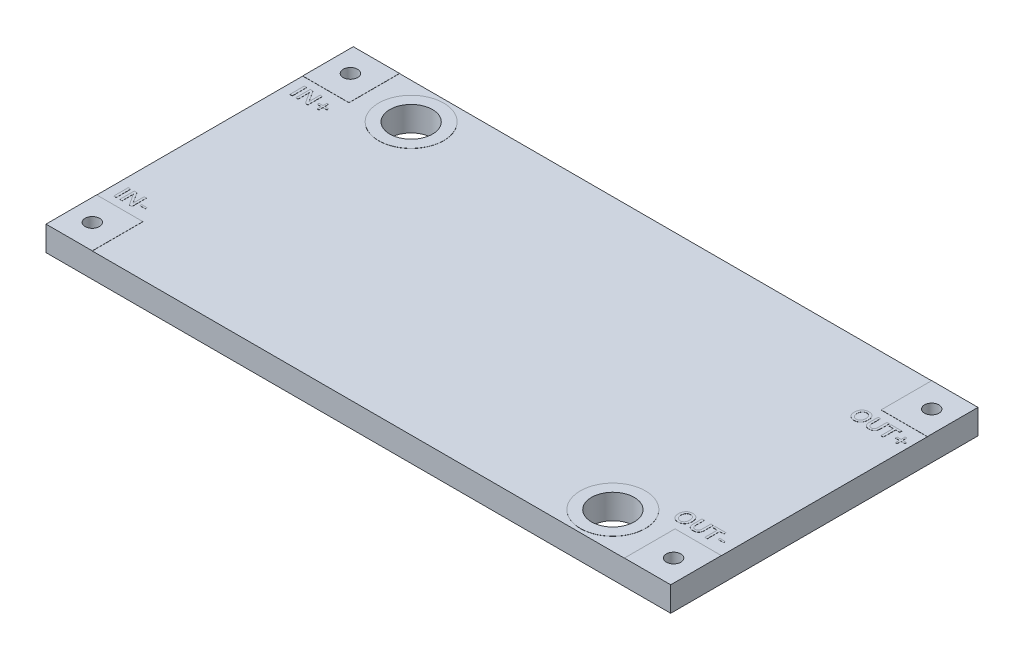
from build123d import *

# Parameters (mm, degrees)
SKETCH1_W           = 43.2
SKETCH1_H           = 21.25
BOSS_EXTRUDE1_DEPTH = 1.7
SKETCH2_R           = 1.475
SKETCH2_R_2         = 0.5
CUT_EXTRUDE1_DEPTH  = 25.131734811
SKETCH3_R           = 2.25
SKETCH3_R_2         = 1.475
SKETCH3_W           = 3.2
SKETCH3_H           = 3.5
SKETCH3_R_3         = 0.5
BOSS_EXTRUDE2_DEPTH = 0.01
SKETCH4_W           = 0.170024671
SKETCH4_H           = 1
SKETCH4_W_2         = 0.37890625
SKETCH4_H_2         = 0.118421053
BOSS_EXTRUDE3_DEPTH = 0.01


with BuildPart() as part:
    # Sketch1 → Boss-Extrude1 (new body)
    with BuildSketch(Plane(origin=(0, 0, 0), x_dir=(1, 0, 0), z_dir=(0, 1, 0))):
        Rectangle(SKETCH1_W, SKETCH1_H)
    extrude(amount=BOSS_EXTRUDE1_DEPTH)

    # Sketch2 → Cut-Extrude1 (cut, through all)
    with BuildSketch(Plane(origin=(0, 0, 0), x_dir=(1, 0, 0), z_dir=(0, 1, 0))):
        with Locations(Location((-15.1, 8.125, 0), (0, 0, 270))):
            Circle(SKETCH2_R)
        with Locations(Location((-20.1, 8.925, 0), (0, 0, 270))):
            Circle(SKETCH2_R_2)
        with Locations(Location((15.1, -8.125, 0), (0, 0, 270))):
            Circle(SKETCH2_R)
        with Locations(Location((20.1, -8.925, 0), (0, 0, 270))):
            Circle(SKETCH2_R_2)
        with Locations(Location((20.1, 8.925, 0), (0, 0, 90))):
            Circle(SKETCH2_R_2)
        with Locations(Location((-20.1, -8.925, 0), (0, 0, 90))):
            Circle(SKETCH2_R_2)
    extrude(amount=CUT_EXTRUDE1_DEPTH, mode=Mode.SUBTRACT)

    # Sketch3 → Boss-Extrude2 (add)
    # profile 1 of 6: a face of its own
    with BuildSketch(Plane(origin=(0, 1.7, 0), x_dir=(1, 0, 0), z_dir=(0, 1, 0))):
        with Locations(Location((-15.1, 8.125, 0), (0, 0, 90))):
            Circle(SKETCH3_R)
        with Locations(Location((-15.1, 8.125, 0), (0, 0, 270))):
            Circle(SKETCH3_R_2, mode=Mode.SUBTRACT)
    # profile 2 of 6: a face of its own
    with BuildSketch(Plane(origin=(0, 1.7, 0), x_dir=(1, 0, 0), z_dir=(0, 1, 0))):
        with Locations(Location((15.1, -8.125, 0), (0, 0, 90))):
            Circle(SKETCH3_R)
        with Locations(Location((15.1, -8.125, 0), (0, 0, 270))):
            Circle(SKETCH3_R_2, mode=Mode.SUBTRACT)
    # profile 3 of 6: a face of its own
    with BuildSketch(Plane(origin=(0, 1.7, 0), x_dir=(1, 0, 0), z_dir=(0, 1, 0))):
        with Locations((-20, 8.875)):
            Rectangle(SKETCH3_W, SKETCH3_H)
        with Locations(Location((-20.1, 8.925, 0), (0, 0, 270))):
            Circle(SKETCH3_R_3, mode=Mode.SUBTRACT)
    # profile 4 of 6: a face of its own
    with BuildSketch(Plane(origin=(0, 1.7, 0), x_dir=(1, 0, 0), z_dir=(0, 1, 0))):
        with Locations((-20, -8.875)):
            Rectangle(SKETCH3_W, SKETCH3_H)
        with Locations(Location((-20.1, -8.925, 0), (0, 0, 90))):
            Circle(SKETCH3_R_3, mode=Mode.SUBTRACT)
    # profile 5 of 6: a face of its own
    with BuildSketch(Plane(origin=(0, 1.7, 0), x_dir=(1, 0, 0), z_dir=(0, 1, 0))):
        with Locations((20, -8.875)):
            Rectangle(SKETCH3_W, SKETCH3_H)
        with Locations(Location((20.1, -8.925, 0), (0, 0, 270))):
            Circle(SKETCH3_R_3, mode=Mode.SUBTRACT)
    # profile 6 of 6: a face of its own
    with BuildSketch(Plane(origin=(0, 1.7, 0), x_dir=(1, 0, 0), z_dir=(0, 1, 0))):
        with Locations((20, 8.875)):
            Rectangle(SKETCH3_W, SKETCH3_H)
        with Locations(Location((20.1, 8.925, 0), (0, 0, 90))):
            Circle(SKETCH3_R_3, mode=Mode.SUBTRACT)
    extrude(amount=BOSS_EXTRUDE2_DEPTH)

    # Sketch4 → Boss-Extrude3 (add)
    # profile 1 of 14: a face of its own
    with BuildSketch(Plane(origin=(0, 1.7, 0), x_dir=(1, 0, 0), z_dir=(0, 1, 0))):
        with Locations((-20.852438923, 6.075899594)):
            Rectangle(SKETCH4_W, SKETCH4_H)
    # profile 2 of 14: a face of its own
    with BuildSketch(Plane(origin=(0, 1.7, 0), x_dir=(1, 0, 0), z_dir=(0, 1, 0))):
        with BuildLine():
            Line((-19.685189745, 5.575899594), (-19.865494021, 5.575899594))
            Line((-19.865494021, 5.575899594), (-20.340822969, 6.31089137))
            add(Edge.make_bspline(
                [(-20.340822969, 6.31089137), (-20.34654146, 6.320295921), (-20.357860845, 6.338911621), (-20.366405755, 6.358952171), (-20.370633824, 6.368868344)],
                knots=[0, 0, 0, 0, 1.010389057, 2, 2, 2, 2], degree=3))
            Line((-20.370633824, 6.368868344), (-20.374745666, 6.368868344))
            add(Edge.make_bspline(
                [(-20.374745666, 6.368868344), (-20.374325341, 6.365785885), (-20.373392772, 6.358946868), (-20.372063704, 6.347515569), (-20.371450169, 6.333779731), (-20.3705252, 6.317752766), (-20.369949118, 6.299449662), (-20.369617758, 6.278819113), (-20.369072437, 6.255932042), (-20.369152789, 6.23989393), (-20.369194679, 6.231532818)],
                knots=[0, 0, 0, 0, 0.542850591, 1.204416297, 2.006997007, 2.940909611, 4.005733812, 5.201725499, 6.541181877, 8, 8, 8, 8], degree=3))
            Line((-20.369194679, 6.231532818), (-20.369194679, 5.575899594))
            Line((-20.369194679, 5.575899594), (-20.528939745, 5.575899594))
            Line((-20.528939745, 5.575899594), (-20.528939745, 6.575899594))
            Line((-20.528939745, 6.575899594), (-20.336711126, 6.575899594))
            Line((-20.336711126, 6.575899594), (-19.877212771, 5.858383147))
            add(Edge.make_bspline(
                [(-19.877212771, 5.858383147), (-19.872803757, 5.851544578), (-19.86472599, 5.839015618), (-19.85411523, 5.821873507), (-19.845964808, 5.808266036), (-19.841625663, 5.800280254), (-19.839795008, 5.796911107)],
                knots=[0, 0, 0, 0, 1.356381881, 2.48503099, 3.360844982, 4, 4, 4, 4], degree=3))
            Line((-19.839795008, 5.796911107), (-19.837122311, 5.796911107))
            add(Edge.make_bspline(
                [(-19.837122311, 5.796911107), (-19.83771686, 5.8004688), (-19.839004079, 5.808171316), (-19.840032502, 5.820758925), (-19.841330637, 5.835000209), (-19.842409475, 5.85096876), (-19.842850435, 5.868663676), (-19.843639937, 5.888119478), (-19.843671104, 5.909302235), (-19.843826334, 5.923967309), (-19.84390685, 5.931573936)],
                knots=[0, 0, 0, 0, 0.641182925, 1.388181035, 2.244403229, 3.184783092, 4.233507647, 5.391855368, 6.647181581, 8, 8, 8, 8], degree=3))
            Line((-19.84390685, 5.931573936), (-19.84390685, 6.575899594))
            Line((-19.84390685, 6.575899594), (-19.685189745, 6.575899594))
            Line((-19.685189745, 6.575899594), (-19.685189745, 5.575899594))
        make_face()
    # profile 3 of 14: a face of its own
    with BuildSketch(Plane(origin=(0, 1.7, 0), x_dir=(1, 0, 0), z_dir=(0, 1, 0))):
        Polygon((-18.731653561, 5.931162752), (-19.005707837, 5.931162752), (-19.005707837, 5.654846962), (-19.12022264, 5.654846962), (-19.12022264, 5.931162752), (-19.394276916, 5.931162752), (-19.394276916, 6.049583805), (-19.12022264, 6.049583805), (-19.12022264, 6.325899594), (-19.005707837, 6.325899594), (-19.005707837, 6.049583805), (-18.731653561, 6.049583805), align=None)
    # profile 4 of 14: a face of its own
    with BuildSketch(Plane(origin=(0, 1.7, 0), x_dir=(1, 0, 0), z_dir=(0, 1, 0))):
        with Locations((-20.852438923, -6.097777607)):
            Rectangle(SKETCH4_W, SKETCH4_H)
    # profile 5 of 14: a face of its own
    with BuildSketch(Plane(origin=(0, 1.7, 0), x_dir=(1, 0, 0), z_dir=(0, 1, 0))):
        with BuildLine():
            Line((-19.685189745, -6.597777607), (-19.865494021, -6.597777607))
            Line((-19.865494021, -6.597777607), (-20.340822969, -5.862785831))
            add(Edge.make_bspline(
                [(-20.340822969, -5.862785831), (-20.34654146, -5.853381281), (-20.357860845, -5.83476558), (-20.366405755, -5.814725031), (-20.370633824, -5.804808857)],
                knots=[0, 0, 0, 0, 1.010389057, 2, 2, 2, 2], degree=3))
            Line((-20.370633824, -5.804808857), (-20.374745666, -5.804808857))
            add(Edge.make_bspline(
                [(-20.374745666, -5.804808857), (-20.374325341, -5.807891316), (-20.373392772, -5.814730333), (-20.372063704, -5.826161632), (-20.371450169, -5.83989747), (-20.3705252, -5.855924436), (-20.369949118, -5.87422754), (-20.369617758, -5.894858089), (-20.369072437, -5.917745159), (-20.369152789, -5.933783271), (-20.369194679, -5.942144384)],
                knots=[0, 0, 0, 0, 0.542850591, 1.204416297, 2.006997007, 2.940909611, 4.005733812, 5.201725499, 6.541181877, 8, 8, 8, 8], degree=3))
            Line((-20.369194679, -5.942144384), (-20.369194679, -6.597777607))
            Line((-20.369194679, -6.597777607), (-20.528939745, -6.597777607))
            Line((-20.528939745, -6.597777607), (-20.528939745, -5.597777607))
            Line((-20.528939745, -5.597777607), (-20.336711126, -5.597777607))
            Line((-20.336711126, -5.597777607), (-19.877212771, -6.315294055))
            add(Edge.make_bspline(
                [(-19.877212771, -6.315294055), (-19.872803757, -6.322132623), (-19.86472599, -6.334661583), (-19.85411523, -6.351803695), (-19.845964808, -6.365411166), (-19.841625663, -6.373396948), (-19.839795008, -6.376766094)],
                knots=[0, 0, 0, 0, 1.356381881, 2.48503099, 3.360844982, 4, 4, 4, 4], degree=3))
            Line((-19.839795008, -6.376766094), (-19.837122311, -6.376766094))
            add(Edge.make_bspline(
                [(-19.837122311, -6.376766094), (-19.83771686, -6.373208401), (-19.839004079, -6.365505886), (-19.840032502, -6.352918277), (-19.841330637, -6.338676992), (-19.842409475, -6.322708442), (-19.842850435, -6.305013525), (-19.843639937, -6.285557723), (-19.843671104, -6.264374967), (-19.843826334, -6.249709892), (-19.84390685, -6.242103265)],
                knots=[0, 0, 0, 0, 0.641182925, 1.388181035, 2.244403229, 3.184783092, 4.233507647, 5.391855368, 6.647181581, 8, 8, 8, 8], degree=3))
            Line((-19.84390685, -6.242103265), (-19.84390685, -5.597777607))
            Line((-19.84390685, -5.597777607), (-19.685189745, -5.597777607))
            Line((-19.685189745, -5.597777607), (-19.685189745, -6.597777607))
        make_face()
    # profile 6 of 14: a face of its own
    with BuildSketch(Plane(origin=(0, 1.7, 0), x_dir=(1, 0, 0), z_dir=(0, 1, 0))):
        with Locations((-19.27020208, -6.209619713)):
            Rectangle(SKETCH4_W_2, SKETCH4_H_2)
    # profile 7 of 14: a face of its own
    with BuildSketch(Plane(origin=(0, 1.7, 0), x_dir=(1, 0, 0), z_dir=(0, 1, 0))):
        with BuildLine():
            add(Edge.make_bspline(
                [(18.082538877, 5.562741699), (18.065044998, 5.563194363), (18.030828975, 5.564079722), (17.980815608, 5.570465796), (17.933499786, 5.581360524), (17.888833922, 5.596613073), (17.84675845, 5.616178356), (17.8075888, 5.640458261), (17.770862125, 5.668768002), (17.737315693, 5.701416599), (17.707239746, 5.737566169), (17.680667293, 5.776359769), (17.658435613, 5.817987884), (17.640031245, 5.862161287), (17.625885134, 5.909016789), (17.61584568, 5.958428037), (17.609819326, 6.010440216), (17.609044893, 6.046003971), (17.608649075, 6.064180844)],
                knots=[0, 0, 0, 0, 1.080688534, 2.113702916, 3.108931422, 4.075669577, 5.024646271, 5.969410339, 6.917101566, 7.884256872, 8.855186167, 9.818171139, 10.784287868, 11.765612141, 12.770163835, 13.803152185, 14.877176389, 16, 16, 16, 16], degree=3))
            add(Edge.make_bspline(
                [(17.608649075, 6.064180844), (17.60902151, 6.083661091), (17.609748676, 6.121695593), (17.616070295, 6.177248847), (17.626175781, 6.229769327), (17.64064918, 6.279255719), (17.659134947, 6.325816033), (17.682007984, 6.369262503), (17.708947669, 6.409707591), (17.739745804, 6.446846772), (17.773991489, 6.480446284), (17.811624929, 6.509586269), (17.8522784, 6.534202395), (17.895794961, 6.554512682), (17.942463245, 6.569754539), (17.991816929, 6.581232651), (18.044261223, 6.587753142), (18.080191318, 6.588616003), (18.098575062, 6.589057489)],
                knots=[0, 0, 0, 0, 1.15222704, 2.249682958, 3.303300419, 4.313064797, 5.295631801, 6.262317599, 7.212562825, 8.165710149, 9.111907019, 10.045395757, 10.97510803, 11.91840756, 12.880046247, 13.874430042, 14.912445645, 16, 16, 16, 16], degree=3))
            add(Edge.make_bspline(
                [(18.098575062, 6.589057489), (18.115657255, 6.58860247), (18.14905297, 6.587712909), (18.197853716, 6.58136688), (18.243997991, 6.570303312), (18.287827157, 6.555465072), (18.328960585, 6.53576357), (18.367478907, 6.511730906), (18.40342934, 6.483361218), (18.436621527, 6.450952989), (18.466476029, 6.415054604), (18.492881339, 6.37641967), (18.514914443, 6.334875364), (18.53277228, 6.290663628), (18.546833159, 6.243868595), (18.556818224, 6.194462892), (18.562877003, 6.142319589), (18.563643239, 6.106686506), (18.564035588, 6.088440712)],
                knots=[0, 0, 0, 0, 1.065808981, 2.083658202, 3.063810198, 4.022601448, 4.965556375, 5.902929278, 6.849938112, 7.817604304, 8.792171557, 9.758797867, 10.732511031, 11.720347187, 12.729563492, 13.777019773, 14.861730821, 16, 16, 16, 16], degree=3))
            add(Edge.make_bspline(
                [(18.564035588, 6.088440712), (18.563661485, 6.068687355), (18.562932134, 6.030176222), (18.556660588, 5.973994363), (18.54639752, 5.920989541), (18.532378357, 5.8709808), (18.513803091, 5.824277725), (18.491027533, 5.780871668), (18.464427597, 5.740413706), (18.433616397, 5.703569218), (18.399487465, 5.67045022), (18.362524502, 5.641383389), (18.322606881, 5.617032475), (18.279895722, 5.597177221), (18.234450178, 5.581779097), (18.186256246, 5.570659835), (18.135286827, 5.564028952), (18.100376708, 5.563177011), (18.082538877, 5.562741699)],
                knots=[0, 0, 0, 0, 1.177234893, 2.295136328, 3.364707178, 4.392715417, 5.386476074, 6.354925964, 7.310067309, 8.267250732, 9.211947684, 10.14028609, 11.064408358, 11.992845631, 12.942370588, 13.919441291, 14.936908422, 16, 16, 16, 16], degree=3))
        make_face()
        with BuildLine():
            add(Edge.make_bspline(
                [(18.090145785, 6.444320647), (18.079027753, 6.443995901), (18.057168711, 6.443357421), (18.025159802, 6.438586548), (17.994769235, 6.430536021), (17.965996639, 6.419392074), (17.938801294, 6.405070541), (17.913177567, 6.387509084), (17.889287751, 6.366567328), (17.867174085, 6.342800187), (17.847220399, 6.316409333), (17.82969933, 6.28787367), (17.81517933, 6.257180426), (17.802804982, 6.22474567), (17.793786127, 6.190025026), (17.786902111, 6.153430984), (17.783065361, 6.114769171), (17.782472364, 6.088380086), (17.782168812, 6.074871633)],
                knots=[0, 0, 0, 0, 0.988164096, 1.942818717, 2.869377484, 3.777873969, 4.679912813, 5.595814758, 6.532869555, 7.498464472, 8.476908715, 9.469532548, 10.469588381, 11.491398077, 12.550994941, 13.653913012, 14.799048759, 16, 16, 16, 16], degree=3))
            add(Edge.make_bspline(
                [(17.782168812, 6.074871633), (17.782378915, 6.061429864), (17.782789346, 6.035171753), (17.78677543, 5.996747958), (17.793330103, 5.960328606), (17.802305788, 5.925827415), (17.814019847, 5.89338011), (17.828548153, 5.863026801), (17.845369286, 5.834481019), (17.864860493, 5.808276182), (17.886398449, 5.784628863), (17.909667641, 5.763876534), (17.934736556, 5.746557285), (17.961298848, 5.732161203), (17.989534538, 5.721041707), (18.019364385, 5.713297834), (18.050716429, 5.708398222), (18.072172129, 5.707789934), (18.083155654, 5.707478541)],
                knots=[0, 0, 0, 0, 1.209576796, 2.362873517, 3.472383614, 4.537664675, 5.56795712, 6.572273746, 7.56245417, 8.545712799, 9.506284641, 10.437062317, 11.345664602, 12.242634409, 13.150985398, 14.06964528, 15.011819787, 16, 16, 16, 16], degree=3))
            add(Edge.make_bspline(
                [(18.083155654, 5.707478541), (18.094752066, 5.707730531), (18.117489057, 5.708224606), (18.150635314, 5.712807811), (18.181840434, 5.720403689), (18.211172317, 5.730950422), (18.238562652, 5.744534178), (18.264120322, 5.761126291), (18.287685831, 5.78082796), (18.309259486, 5.803459959), (18.328539045, 5.828813596), (18.345573208, 5.856500131), (18.359683026, 5.886772442), (18.371549602, 5.919329911), (18.380111738, 5.954477323), (18.386802424, 5.991806843), (18.390708332, 6.031545582), (18.391124716, 6.05882698), (18.391338219, 6.072815712)],
                knots=[0, 0, 0, 0, 1.028528343, 2.016627255, 2.961983855, 3.873731828, 4.776575143, 5.668789617, 6.571141343, 7.495835697, 8.437174697, 9.392452997, 10.374395704, 11.395763051, 12.462046906, 13.579731582, 14.758990046, 16, 16, 16, 16], degree=3))
            add(Edge.make_bspline(
                [(18.391338219, 6.072815712), (18.391105827, 6.087213871), (18.390653507, 6.115237857), (18.387029599, 6.156006274), (18.380514348, 6.194224153), (18.372192655, 6.230035074), (18.3606639, 6.263195046), (18.347080713, 6.293996634), (18.330423513, 6.322033421), (18.311820512, 6.347694121), (18.290709242, 6.370321004), (18.267825576, 6.390303328), (18.242780224, 6.407023859), (18.21581917, 6.420633411), (18.187091484, 6.431417144), (18.156459199, 6.438957789), (18.123937438, 6.443602039), (18.101606519, 6.444076924), (18.090145785, 6.444320647)],
                knots=[0, 0, 0, 0, 1.275930431, 2.483418728, 3.622659341, 4.709777534, 5.737328229, 6.729540964, 7.687827304, 8.621963811, 9.533051901, 10.424350274, 11.308689573, 12.194154331, 13.095493964, 14.02201801, 14.984854798, 16, 16, 16, 16], degree=3))
        make_face(mode=Mode.SUBTRACT)
    # profile 8 of 14: a face of its own
    with BuildSketch(Plane(origin=(0, 1.7, 0), x_dir=(1, 0, 0), z_dir=(0, 1, 0))):
        with BuildLine():
            add(Edge.make_bspline(
                [(19.516749404, 5.982560778), (19.516411646, 5.965624383), (19.515755385, 5.932717131), (19.511332863, 5.885000437), (19.503575875, 5.840570286), (19.492613111, 5.799469759), (19.47908452, 5.761415595), (19.461798974, 5.726814906), (19.441721941, 5.695354451), (19.418194622, 5.667269857), (19.391559503, 5.642538617), (19.361897045, 5.620982298), (19.329158737, 5.602705742), (19.29313322, 5.588315171), (19.254212416, 5.576664643), (19.21219367, 5.568644374), (19.167092115, 5.563595055), (19.136007101, 5.563032282), (19.11995664, 5.562741699)],
                knots=[0, 0, 0, 0, 1.226853155, 2.383763919, 3.467655837, 4.490011703, 5.462137187, 6.387943758, 7.285775493, 8.159766112, 9.034419151, 9.912222379, 10.810054113, 11.743007316, 12.716842562, 13.748867616, 14.83764852, 16, 16, 16, 16], degree=3))
            add(Edge.make_bspline(
                [(19.11995664, 5.562741699), (19.104592333, 5.563051613), (19.074747085, 5.563653623), (19.031505148, 5.568459261), (18.991188777, 5.576067695), (18.953905028, 5.587305339), (18.919468745, 5.601313217), (18.88803203, 5.618825872), (18.859517761, 5.639309299), (18.834247576, 5.663355511), (18.811598667, 5.690167835), (18.792266776, 5.720436525), (18.775961831, 5.753855057), (18.76268836, 5.790405584), (18.752173971, 5.830027578), (18.744973428, 5.872768112), (18.74030133, 5.918586193), (18.739846213, 5.95020201), (18.739611246, 5.966524594)],
                knots=[0, 0, 0, 0, 1.158846926, 2.251066199, 3.278205435, 4.249804329, 5.184010756, 6.07736631, 6.958474974, 7.825285059, 8.702395332, 9.600153407, 10.527352038, 11.502219312, 12.529306499, 13.615587086, 14.768977538, 16, 16, 16, 16], degree=3))
            Line((18.739611246, 5.966524594), (18.739611246, 6.575899594))
            Line((18.739611246, 6.575899594), (18.904701706, 6.575899594))
            Line((18.904701706, 6.575899594), (18.904701706, 6.000652883))
            add(Edge.make_bspline(
                [(18.904701706, 6.000652883), (18.904832494, 5.988791782), (18.905085361, 5.965859347), (18.907794079, 5.932554037), (18.912270898, 5.901585907), (18.918358355, 5.872825135), (18.926327228, 5.846374542), (18.936246874, 5.822251974), (18.947631837, 5.800251077), (18.961231875, 5.780814212), (18.97614746, 5.763308324), (18.993318524, 5.748432643), (19.01204245, 5.735516783), (19.032811543, 5.725294455), (19.055218459, 5.717216082), (19.079347741, 5.711476317), (19.105271959, 5.708242551), (19.123100073, 5.707738452), (19.132292167, 5.707478541)],
                knots=[0, 0, 0, 0, 1.343123546, 2.596815513, 3.781197858, 4.884908217, 5.923490635, 6.905054976, 7.835546472, 8.72258405, 9.586361395, 10.433341515, 11.288004071, 12.15578242, 13.04702078, 13.980776091, 14.958897414, 16, 16, 16, 16], degree=3))
            add(Edge.make_bspline(
                [(19.132292167, 5.707478541), (19.141143849, 5.707647559), (19.158364259, 5.707976373), (19.183364407, 5.711340795), (19.206701879, 5.716776964), (19.22824198, 5.724708847), (19.248166731, 5.734505433), (19.266232448, 5.746815818), (19.282614926, 5.761318407), (19.297206908, 5.77811642), (19.310311552, 5.796931718), (19.321358551, 5.81813398), (19.330822375, 5.841390079), (19.338398767, 5.86695466), (19.344273767, 5.894669401), (19.34851486, 5.924548313), (19.351292711, 5.956603771), (19.351533998, 5.978716862), (19.351658943, 5.990167686)],
                knots=[0, 0, 0, 0, 1.039273001, 2.021842695, 2.957137814, 3.848510232, 4.71256286, 5.558805872, 6.408526268, 7.275648631, 8.166657446, 9.095765165, 10.077939035, 11.111960622, 12.223548368, 13.403025483, 14.655208456, 16, 16, 16, 16], degree=3))
            Line((19.351658943, 5.990167686), (19.351658943, 6.575899594))
            Line((19.351658943, 6.575899594), (19.516749404, 6.575899594))
            Line((19.516749404, 6.575899594), (19.516749404, 5.982560778))
        make_face()
    # profile 9 of 14: a face of its own
    with BuildSketch(Plane(origin=(0, 1.7, 0), x_dir=(1, 0, 0), z_dir=(0, 1, 0))):
        Polygon((20.389693483, 6.431162752), (20.103920456, 6.431162752), (20.103920456, 5.575899594), (19.938829996, 5.575899594), (19.938829996, 6.431162752), (19.653673746, 6.431162752), (19.653673746, 6.575899594), (20.389693483, 6.575899594), align=None)
    # profile 10 of 14: a face of its own
    with BuildSketch(Plane(origin=(0, 1.7, 0), x_dir=(1, 0, 0), z_dir=(0, 1, 0))):
        Polygon((21.245984601, 5.931162752), (20.971930325, 5.931162752), (20.971930325, 5.654846962), (20.857415522, 5.654846962), (20.857415522, 5.931162752), (20.583361246, 5.931162752), (20.583361246, 6.049583805), (20.857415522, 6.049583805), (20.857415522, 6.325899594), (20.971930325, 6.325899594), (20.971930325, 6.049583805), (21.245984601, 6.049583805), align=None)
    # profile 11 of 14: a face of its own
    with BuildSketch(Plane(origin=(0, 1.7, 0), x_dir=(1, 0, 0), z_dir=(0, 1, 0))):
        with BuildLine():
            add(Edge.make_bspline(
                [(18.082538877, -6.610935502), (18.065044998, -6.610482838), (18.030828975, -6.60959748), (17.980815608, -6.603211406), (17.933499786, -6.592316677), (17.888833922, -6.577064128), (17.84675845, -6.557498846), (17.8075888, -6.53321894), (17.770862125, -6.504909199), (17.737315693, -6.472260602), (17.707239746, -6.436111032), (17.680667293, -6.397317433), (17.658435613, -6.355689317), (17.640031245, -6.311515914), (17.625885134, -6.264660412), (17.61584568, -6.215249164), (17.609819326, -6.163236985), (17.609044893, -6.12767323), (17.608649075, -6.109496357)],
                knots=[0, 0, 0, 0, 1.080688534, 2.113702916, 3.108931422, 4.075669577, 5.024646271, 5.969410339, 6.917101566, 7.884256872, 8.855186167, 9.818171139, 10.784287868, 11.765612141, 12.770163835, 13.803152185, 14.877176389, 16, 16, 16, 16], degree=3))
            add(Edge.make_bspline(
                [(17.608649075, -6.109496357), (17.60902151, -6.09001611), (17.609748676, -6.051981609), (17.616070295, -5.996428354), (17.626175781, -5.943907874), (17.64064918, -5.894421483), (17.659134947, -5.847861168), (17.682007984, -5.804414698), (17.708947669, -5.76396961), (17.739745804, -5.726830429), (17.773991489, -5.693230918), (17.811624929, -5.664090932), (17.8522784, -5.639474806), (17.895794961, -5.619164519), (17.942463245, -5.603922662), (17.991816929, -5.59244455), (18.044261223, -5.58592406), (18.080191318, -5.585061198), (18.098575062, -5.584619713)],
                knots=[0, 0, 0, 0, 1.15222704, 2.249682958, 3.303300419, 4.313064797, 5.295631801, 6.262317599, 7.212562825, 8.165710149, 9.111907019, 10.045395757, 10.97510803, 11.91840756, 12.880046247, 13.874430042, 14.912445645, 16, 16, 16, 16], degree=3))
            add(Edge.make_bspline(
                [(18.098575062, -5.584619713), (18.115657255, -5.585074731), (18.14905297, -5.585964292), (18.197853716, -5.592310321), (18.243997991, -5.60337389), (18.287827157, -5.618212129), (18.328960585, -5.637913631), (18.367478907, -5.661946295), (18.40342934, -5.690315983), (18.436621527, -5.722724212), (18.466476029, -5.758622598), (18.492881339, -5.797257531), (18.514914443, -5.838801837), (18.53277228, -5.883013573), (18.546833159, -5.929808606), (18.556818224, -5.97921431), (18.562877003, -6.031357613), (18.563643239, -6.066990695), (18.564035588, -6.085236489)],
                knots=[0, 0, 0, 0, 1.065808981, 2.083658202, 3.063810198, 4.022601448, 4.965556375, 5.902929278, 6.849938112, 7.817604304, 8.792171557, 9.758797867, 10.732511031, 11.720347187, 12.729563492, 13.777019773, 14.861730821, 16, 16, 16, 16], degree=3))
            add(Edge.make_bspline(
                [(18.564035588, -6.085236489), (18.563661485, -6.104989847), (18.562932134, -6.143500979), (18.556660588, -6.199682838), (18.54639752, -6.252687661), (18.532378357, -6.302696401), (18.513803091, -6.349399476), (18.491027533, -6.392805534), (18.464427597, -6.433263496), (18.433616397, -6.470107983), (18.399487465, -6.503226981), (18.362524502, -6.532293812), (18.322606881, -6.556644726), (18.279895722, -6.57649998), (18.234450178, -6.591898104), (18.186256246, -6.603017366), (18.135286827, -6.609648249), (18.100376708, -6.61050019), (18.082538877, -6.610935502)],
                knots=[0, 0, 0, 0, 1.177234893, 2.295136328, 3.364707178, 4.392715417, 5.386476074, 6.354925964, 7.310067309, 8.267250732, 9.211947684, 10.14028609, 11.064408358, 11.992845631, 12.942370588, 13.919441291, 14.936908422, 16, 16, 16, 16], degree=3))
        make_face()
        with BuildLine():
            add(Edge.make_bspline(
                [(18.090145785, -5.729356555), (18.079027753, -5.729681301), (18.057168711, -5.73031978), (18.025159802, -5.735090653), (17.994769235, -5.74314118), (17.965996639, -5.754285127), (17.938801294, -5.768606661), (17.913177567, -5.786168118), (17.889287751, -5.807109873), (17.867174085, -5.830877015), (17.847220399, -5.857267868), (17.82969933, -5.885803531), (17.81517933, -5.916496775), (17.802804982, -5.948931531), (17.793786127, -5.983652175), (17.786902111, -6.020246217), (17.783065361, -6.05890803), (17.782472364, -6.085297115), (17.782168812, -6.098805568)],
                knots=[0, 0, 0, 0, 0.988164096, 1.942818717, 2.869377484, 3.777873969, 4.679912813, 5.595814758, 6.532869555, 7.498464472, 8.476908715, 9.469532548, 10.469588381, 11.491398077, 12.550994941, 13.653913012, 14.799048759, 16, 16, 16, 16], degree=3))
            add(Edge.make_bspline(
                [(17.782168812, -6.098805568), (17.782378915, -6.112247337), (17.782789346, -6.138505448), (17.78677543, -6.176929243), (17.793330103, -6.213348595), (17.802305788, -6.247849787), (17.814019847, -6.280297091), (17.828548153, -6.3106504), (17.845369286, -6.339196182), (17.864860493, -6.365401019), (17.886398449, -6.389048338), (17.909667641, -6.409800668), (17.934736556, -6.427119916), (17.961298848, -6.441515998), (17.989534538, -6.452635494), (18.019364385, -6.460379368), (18.050716429, -6.465278979), (18.072172129, -6.465887267), (18.083155654, -6.46619866)],
                knots=[0, 0, 0, 0, 1.209576796, 2.362873517, 3.472383614, 4.537664675, 5.56795712, 6.572273746, 7.56245417, 8.545712799, 9.506284641, 10.437062317, 11.345664602, 12.242634409, 13.150985398, 14.06964528, 15.011819787, 16, 16, 16, 16], degree=3))
            add(Edge.make_bspline(
                [(18.083155654, -6.46619866), (18.094752066, -6.46594667), (18.117489057, -6.465452596), (18.150635314, -6.460869391), (18.181840434, -6.453273512), (18.211172317, -6.442726779), (18.238562652, -6.429143023), (18.264120322, -6.41255091), (18.287685831, -6.392849241), (18.309259486, -6.370217242), (18.328539045, -6.344863606), (18.345573208, -6.31717707), (18.359683026, -6.286904759), (18.371549602, -6.25434729), (18.380111738, -6.219199879), (18.386802424, -6.181870358), (18.390708332, -6.14213162), (18.391124716, -6.114850221), (18.391338219, -6.100861489)],
                knots=[0, 0, 0, 0, 1.028528343, 2.016627255, 2.961983855, 3.873731828, 4.776575143, 5.668789617, 6.571141343, 7.495835697, 8.437174697, 9.392452997, 10.374395704, 11.395763051, 12.462046906, 13.579731582, 14.758990046, 16, 16, 16, 16], degree=3))
            add(Edge.make_bspline(
                [(18.391338219, -6.100861489), (18.391105827, -6.08646333), (18.390653507, -6.058439345), (18.387029599, -6.017670927), (18.380514348, -5.979453048), (18.372192655, -5.943642127), (18.3606639, -5.910482155), (18.347080713, -5.879680567), (18.330423513, -5.85164378), (18.311820512, -5.82598308), (18.290709242, -5.803356198), (18.267825576, -5.783373873), (18.242780224, -5.766653342), (18.21581917, -5.75304379), (18.187091484, -5.742260057), (18.156459199, -5.734719413), (18.123937438, -5.730075163), (18.101606519, -5.729600277), (18.090145785, -5.729356555)],
                knots=[0, 0, 0, 0, 1.275930431, 2.483418728, 3.622659341, 4.709777534, 5.737328229, 6.729540964, 7.687827304, 8.621963811, 9.533051901, 10.424350274, 11.308689573, 12.194154331, 13.095493964, 14.02201801, 14.984854798, 16, 16, 16, 16], degree=3))
        make_face(mode=Mode.SUBTRACT)
    # profile 12 of 14: a face of its own
    with BuildSketch(Plane(origin=(0, 1.7, 0), x_dir=(1, 0, 0), z_dir=(0, 1, 0))):
        with BuildLine():
            add(Edge.make_bspline(
                [(19.516749404, -6.191116423), (19.516411646, -6.208052818), (19.515755385, -6.240960071), (19.511332863, -6.288676765), (19.503575875, -6.333106915), (19.492613111, -6.374207443), (19.47908452, -6.412261607), (19.461798974, -6.446862296), (19.441721941, -6.47832275), (19.418194622, -6.506407345), (19.391559503, -6.531138584), (19.361897045, -6.552694903), (19.329158737, -6.570971459), (19.29313322, -6.58536203), (19.254212416, -6.597012558), (19.21219367, -6.605032827), (19.167092115, -6.610082146), (19.136007101, -6.610644919), (19.11995664, -6.610935502)],
                knots=[0, 0, 0, 0, 1.226853155, 2.383763919, 3.467655837, 4.490011703, 5.462137187, 6.387943758, 7.285775493, 8.159766112, 9.034419151, 9.912222379, 10.810054113, 11.743007316, 12.716842562, 13.748867616, 14.83764852, 16, 16, 16, 16], degree=3))
            add(Edge.make_bspline(
                [(19.11995664, -6.610935502), (19.104592333, -6.610625588), (19.074747085, -6.610023578), (19.031505148, -6.60521794), (18.991188777, -6.597609506), (18.953905028, -6.586371863), (18.919468745, -6.572363985), (18.88803203, -6.554851329), (18.859517761, -6.534367902), (18.834247576, -6.51032169), (18.811598667, -6.483509367), (18.792266776, -6.453240676), (18.775961831, -6.419822144), (18.76268836, -6.383271618), (18.752173971, -6.343649623), (18.744973428, -6.300909089), (18.74030133, -6.255091008), (18.739846213, -6.223475191), (18.739611246, -6.207152607)],
                knots=[0, 0, 0, 0, 1.158846926, 2.251066199, 3.278205435, 4.249804329, 5.184010756, 6.07736631, 6.958474974, 7.825285059, 8.702395332, 9.600153407, 10.527352038, 11.502219312, 12.529306499, 13.615587086, 14.768977538, 16, 16, 16, 16], degree=3))
            Line((18.739611246, -6.207152607), (18.739611246, -5.597777607))
            Line((18.739611246, -5.597777607), (18.904701706, -5.597777607))
            Line((18.904701706, -5.597777607), (18.904701706, -6.173024318))
            add(Edge.make_bspline(
                [(18.904701706, -6.173024318), (18.904832494, -6.184885419), (18.905085361, -6.207817854), (18.907794079, -6.241123164), (18.912270898, -6.272091294), (18.918358355, -6.300852066), (18.926327228, -6.327302659), (18.936246874, -6.351425227), (18.947631837, -6.373426124), (18.961231875, -6.39286299), (18.97614746, -6.410368877), (18.993318524, -6.425244558), (19.01204245, -6.438160418), (19.032811543, -6.448382746), (19.055218459, -6.456461119), (19.079347741, -6.462200884), (19.105271959, -6.46543465), (19.123100073, -6.465938749), (19.132292167, -6.46619866)],
                knots=[0, 0, 0, 0, 1.343123546, 2.596815513, 3.781197858, 4.884908217, 5.923490635, 6.905054976, 7.835546472, 8.72258405, 9.586361395, 10.433341515, 11.288004071, 12.15578242, 13.04702078, 13.980776091, 14.958897414, 16, 16, 16, 16], degree=3))
            add(Edge.make_bspline(
                [(19.132292167, -6.46619866), (19.141143849, -6.466029642), (19.158364259, -6.465700828), (19.183364407, -6.462336406), (19.206701879, -6.456900238), (19.22824198, -6.448968354), (19.248166731, -6.439171768), (19.266232448, -6.426861383), (19.282614926, -6.412358794), (19.297206908, -6.395560782), (19.310311552, -6.376745483), (19.321358551, -6.355543221), (19.330822375, -6.332287123), (19.338398767, -6.306722541), (19.344273767, -6.2790078), (19.34851486, -6.249128888), (19.351292711, -6.21707343), (19.351533998, -6.194960339), (19.351658943, -6.183509515)],
                knots=[0, 0, 0, 0, 1.039273001, 2.021842695, 2.957137814, 3.848510232, 4.71256286, 5.558805872, 6.408526268, 7.275648631, 8.166657446, 9.095765165, 10.077939035, 11.111960622, 12.223548368, 13.403025483, 14.655208456, 16, 16, 16, 16], degree=3))
            Line((19.351658943, -6.183509515), (19.351658943, -5.597777607))
            Line((19.351658943, -5.597777607), (19.516749404, -5.597777607))
            Line((19.516749404, -5.597777607), (19.516749404, -6.191116423))
        make_face()
    # profile 13 of 14: a face of its own
    with BuildSketch(Plane(origin=(0, 1.7, 0), x_dir=(1, 0, 0), z_dir=(0, 1, 0))):
        Polygon((20.389693483, -5.742514449), (20.103920456, -5.742514449), (20.103920456, -6.597777607), (19.938829996, -6.597777607), (19.938829996, -5.742514449), (19.653673746, -5.742514449), (19.653673746, -5.597777607), (20.389693483, -5.597777607), align=None)
    # profile 14 of 14: a face of its own
    with BuildSketch(Plane(origin=(0, 1.7, 0), x_dir=(1, 0, 0), z_dir=(0, 1, 0))):
        with Locations((20.707436081, -6.209619713)):
            Rectangle(SKETCH4_W_2, SKETCH4_H_2)
    extrude(amount=BOSS_EXTRUDE3_DEPTH)


solid = part.part
